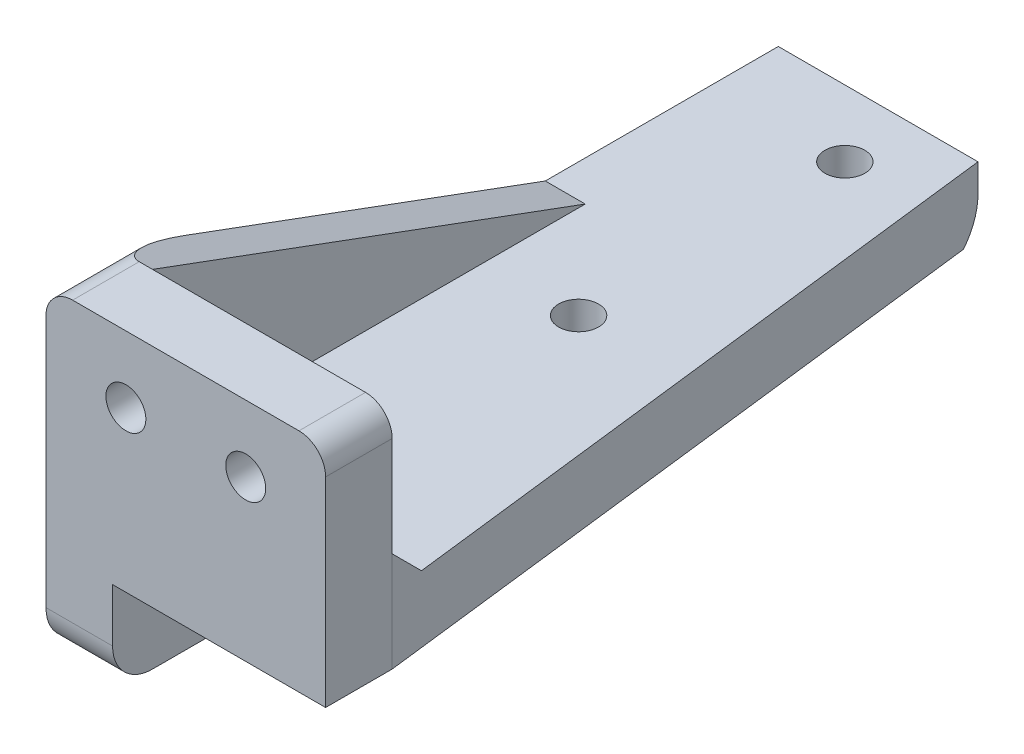
from build123d import *

# Parameters (mm, degrees)
SKETCH_1_W          = 15
SKETCH_1_H          = 50
EXTRUDE_1_DEPTH     = 5
SKETCH_3_W          = 50
SKETCH_3_H          = 1
SKETCH_3_W_2        = 10
SKETCH_3_H_2        = 5
EXTRUDE_2_DEPTH     = 5
FILLET_1_R          = 4
FILLET_2_R          = 2
SKETCH_4_R          = 1.5
CUT_EXTRUDE_1_DEPTH = 5
SKETCH_5_R          = 1.5
EXTRUDE_3_DEPTH     = 5
CHAMFER_1_SIZE      = 2.5
FILLET_4_R          = 3
EXTRUDE_4_DEPTH     = 3
FILLET_5_R          = 2


with BuildPart() as part:
    # 草图1 → 凸台-拉伸1 (new body)
    with BuildSketch(Plane(origin=(0, 0, 0), x_dir=(1, 0, 0), z_dir=(0, 1, 0))):
        Rectangle(SKETCH_1_W, SKETCH_1_H)
        Polygon((7.5, -25), (13.5, -25), (7.5, 25), align=None)
    extrude(amount=EXTRUDE_1_DEPTH)

    # 草图3 → 凸台-拉伸2 (add)
    with BuildSketch(Plane.ZY.offset(7.5)):
        with Locations((0, -0.5)):
            Rectangle(SKETCH_3_W, SKETCH_3_H)
        Polygon((15, -2), (25, -2), (25, -1), (-25, -1), align=None)
        with Locations((20, -4.5)):
            Rectangle(SKETCH_3_W_2, SKETCH_3_H_2)
    extrude(amount=-EXTRUDE_2_DEPTH)

    # 圆角1
    fillet_1_edges = [part.edges().sort_by_distance(p)[0] for p in [
        (-5, -1, -25),
    ]]
    fillet(fillet_1_edges, radius=FILLET_1_R)

    # 圆角2
    fillet_2_edges = [part.edges().sort_by_distance(p)[0] for p in [
        (-5, -7, 15),
    ]]
    fillet(fillet_2_edges, radius=FILLET_2_R)

    # 草图4 → 切除-拉伸1 (cut)
    with BuildSketch(Plane.XZ):
        with Locations(Location((2.5, 20, 0), (0, 0, 270))):
            Circle(SKETCH_4_R)
        with Locations(Location((2.5, 0, 0), (0, 0, 270))):
            Circle(SKETCH_4_R)
        with Locations(Location((2.5, -20, 0), (0, 0, 270))):
            Circle(SKETCH_4_R)
    extrude(amount=-CUT_EXTRUDE_1_DEPTH, mode=Mode.SUBTRACT)

    # 草图5 → 凸台-拉伸3 (add)
    with BuildSketch(Plane.XY.offset(25)):
        Polygon((13.5, 5), (13.5, 0), (-2.5, 0), (-2.5, -7), (-7.5, -7), (-7.5, 5), (-7.5, 17), (13.5, 17), align=None)
        with Locations((-1.5, 12)):
            Circle(SKETCH_5_R, mode=Mode.SUBTRACT)
        with Locations((7.5, 12)):
            Circle(SKETCH_5_R, mode=Mode.SUBTRACT)
    extrude(amount=EXTRUDE_3_DEPTH)

    # 倒角1
    chamfer_1_edges = [part.edges().sort_by_distance(p)[0] for p in [
        (3, 5, 25),
    ]]
    chamfer(chamfer_1_edges, length=CHAMFER_1_SIZE)

    # 圆角4
    fillet_4_edges = [part.edges().sort_by_distance(p)[0] for p in [
        (-5, -7, 30),
    ]]
    fillet(fillet_4_edges, radius=FILLET_4_R)

    # 草图6 → 凸台-拉伸4 (add)
    with BuildSketch(Plane.ZY.offset(7.5)):
        Polygon((25, 17), (25, 7.5), (22.5, 5), (-7.5, 5), align=None)
    extrude(amount=-EXTRUDE_4_DEPTH)

    # 圆角5
    fillet_5_edges = [part.edges().sort_by_distance(p)[0] for p in [
        (13.5, 17, 27.5),
        (-7.5, 17, 27.5),
    ]]
    fillet(fillet_5_edges, radius=FILLET_5_R)


solid = part.part
